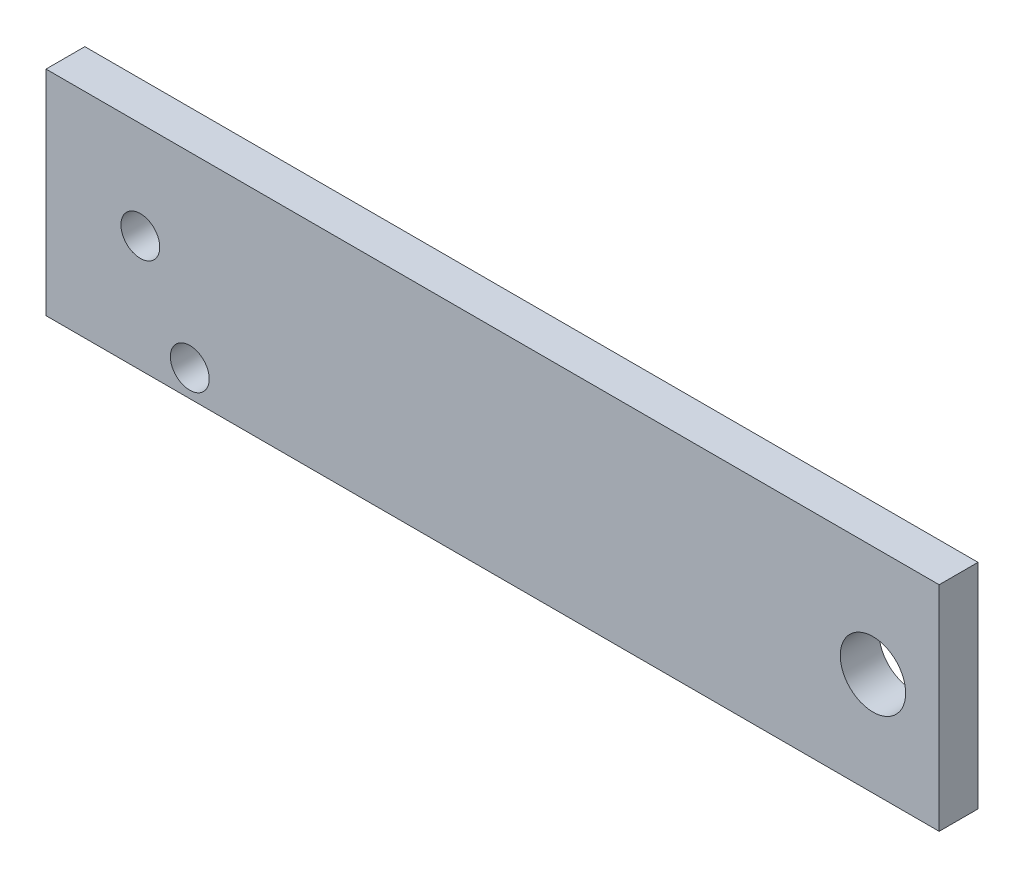
from build123d import *

# Parameters (mm, degrees)
SKETCH_1_W               = 500
SKETCH_1_H               = 110
SKETCH_1_R               = 16.844258013
SKETCH_1_R_2             = 10
EXTRUDE_1_DEPTH          = 20
CUT_EXTRUDE_1_DEPTH      = 274.861278753
CUT_EXTRUDE_1_DEPTH_BACK = 274.861278753


with BuildPart() as part:
    # 草图1 → 凸台-拉伸1 (new body)
    with BuildSketch(Plane.XY):
        with Locations((0, 55)):
            Rectangle(SKETCH_1_W, SKETCH_1_H)
        with Locations((175.900033463, 52.997126546)):
            Circle(SKETCH_1_R, mode=Mode.SUBTRACT)
        with Locations((-175.9468126, 13.777754179)):
            Circle(SKETCH_1_R_2, mode=Mode.SUBTRACT)
        with Locations((-201.422811837, 59.841384559)):
            Circle(SKETCH_1_R_2, mode=Mode.SUBTRACT)
    extrude(amount=EXTRUDE_1_DEPTH)

    # 草图2 → 切除-拉伸1 (cut, two sides: drawn at the far end of the back side and taken through both)
    with BuildSketch(Plane.XY.offset(20).offset(-CUT_EXTRUDE_1_DEPTH_BACK)):
        Polygon((1297.820746048, 138.80913238), (250, 138.80913238), (210, 138.80913238), (210, -127.893820907), (210, -1175.714566955), (1824.507064902, -2511.783502593), (2912.32781095, -1197.259803259), align=None)
    extrude(amount=CUT_EXTRUDE_1_DEPTH + CUT_EXTRUDE_1_DEPTH_BACK, mode=Mode.SUBTRACT)


solid = part.part
